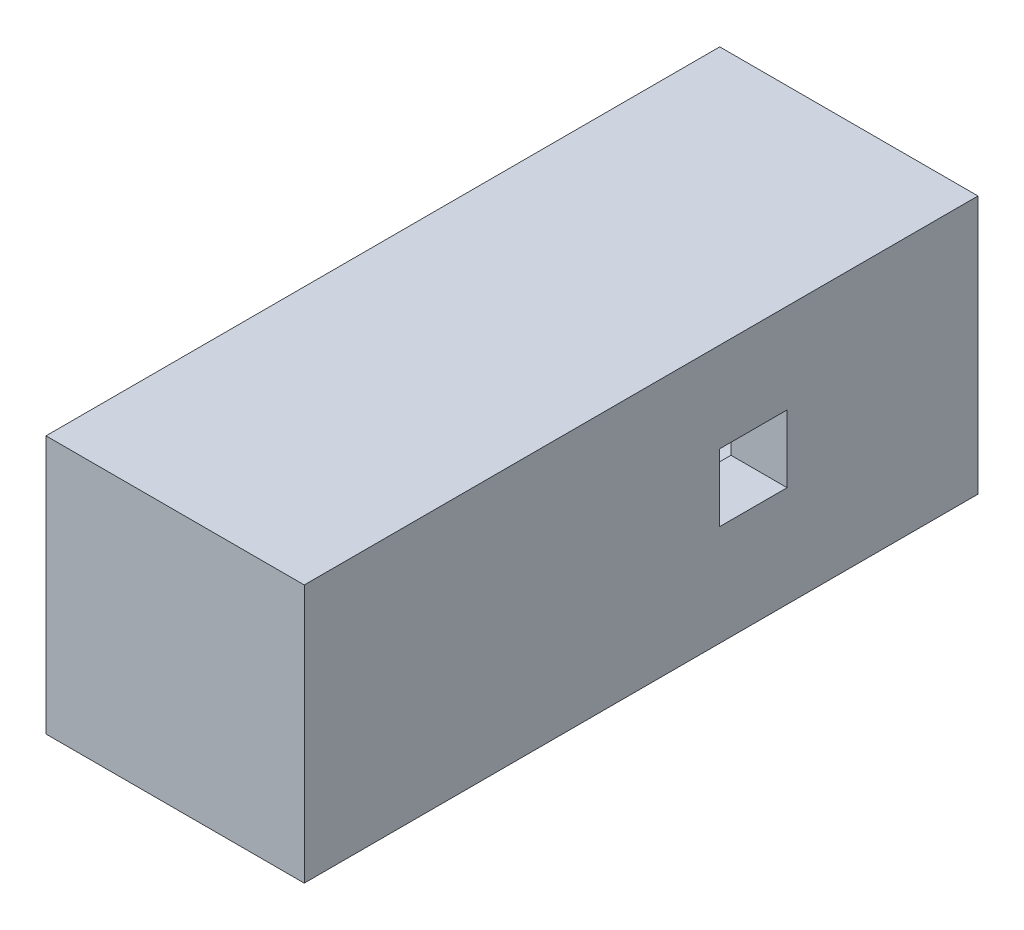
from build123d import *

# Parameters (mm, degrees)
SKETCH_3_W          = 23
SKETCH_3_H          = 23
SKETCH_3_W_2        = 13
SKETCH_3_H_2        = 13
EXTRUDE_1_DEPTH     = 33
SKETCH_6_W          = 23
SKETCH_6_H          = 23
EXTRUDE_3_DEPTH     = 27
SKETCH_9_W          = 6
SKETCH_9_H          = 6
EXTRUDE_5_DEPTH     = 5
SKETCH_9_2_W        = 6
SKETCH_9_2_H        = 6
CUT_EXTRUDE_3_DEPTH = 5
SKETCH_10_W         = 2
SKETCH_10_H         = 6
CUT_EXTRUDE_4_DEPTH = 5


with BuildPart() as part:
    # 草图3 → 凸台-拉伸1 (new body)
    with BuildSketch(Plane.XY):
        with Locations((-11.5, 11.5)):
            Rectangle(SKETCH_3_W, SKETCH_3_H)
        with Locations((-11.5, 11.5)):
            Rectangle(SKETCH_3_W_2, SKETCH_3_H_2, mode=Mode.SUBTRACT)
    extrude(amount=EXTRUDE_1_DEPTH)

    # 草图6 → 凸台-拉伸3 (add)
    with BuildSketch(Plane.XY.offset(33)):
        with Locations((-11.5, 11.5)):
            Rectangle(SKETCH_6_W, SKETCH_6_H)
    extrude(amount=EXTRUDE_3_DEPTH)

    # 草图9 → 凸台-拉伸5 (add)
    with BuildSketch(Plane(origin=(0, 0, 0), x_dir=(0, 0, -1), z_dir=(1, 0, 0))):
        with Locations((-20, 12)):
            Rectangle(SKETCH_9_W, SKETCH_9_H)
    extrude(amount=-EXTRUDE_5_DEPTH)

    # 草图9<2> → 切除-拉伸3 (cut)
    with BuildSketch(Plane(origin=(0, 0, 0), x_dir=(0, 0, -1), z_dir=(1, 0, 0))):
        with Locations((-20, 12)):
            Rectangle(SKETCH_9_2_W, SKETCH_9_2_H)
    extrude(amount=-CUT_EXTRUDE_3_DEPTH, mode=Mode.SUBTRACT)

    # 草图10 → 切除-拉伸4 (cut)
    with BuildSketch(Plane.ZY.offset(23)):
        with Locations((20, 12)):
            Rectangle(SKETCH_10_W, SKETCH_10_H)
    extrude(amount=-CUT_EXTRUDE_4_DEPTH, mode=Mode.SUBTRACT)


solid = part.part
